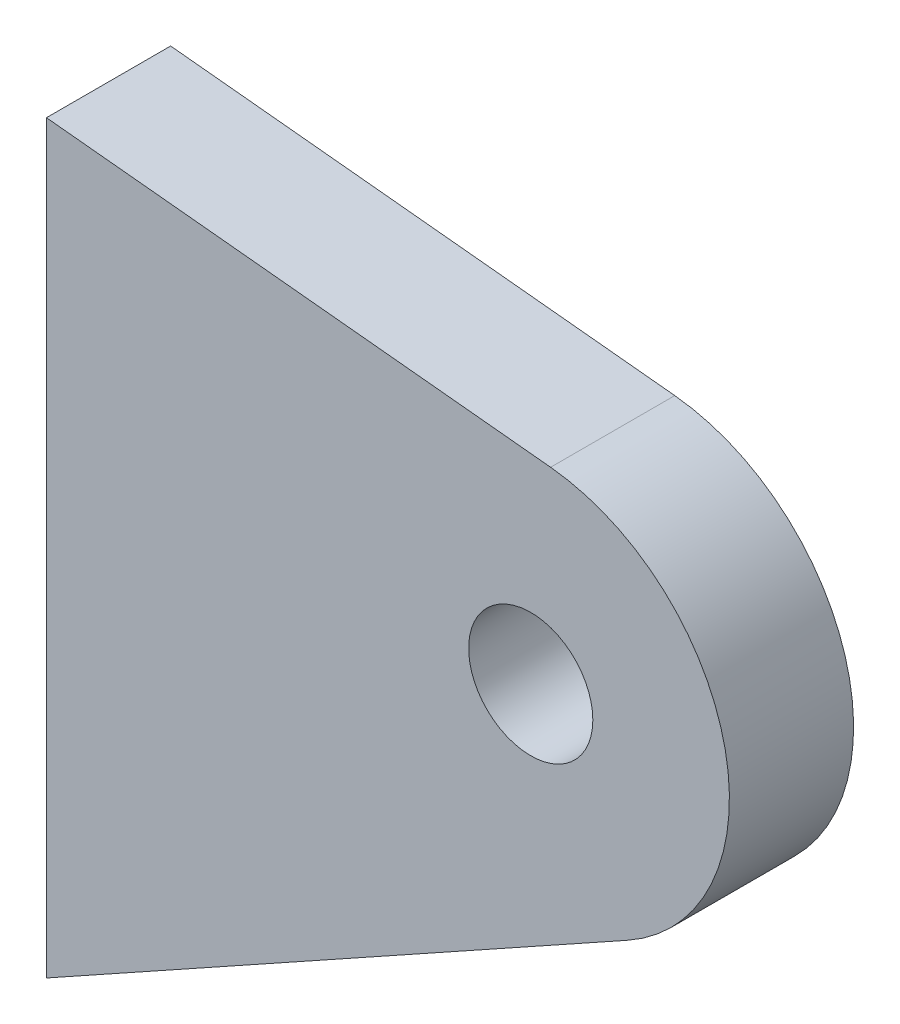
from build123d import *

# Parameters (mm, degrees)
ESQUISSE1_R               = 2.5
EXTRUSION1_DEPTH          = 5
TROU_TARAUD_M3X0_51_D     = 2.5
TROU_TARAUD_M3X0_51_DEPTH = 9.1
TROU_TARAUD_M3X0_51_TIP   = 0.751075774


with BuildPart() as part:
    # Esquisse1 → Extrusion1 (new body)
    with BuildSketch(Plane.XY):
        with BuildLine():
            Line((-19.5, 10), (-19.5, -20))
            Line((-19.5, -20), (3.888568512, -6.991354299))
            ThreePointArc((3.888568512, -6.991354299), (7.834576447, 1.618459728), (0.799950986, 7.959904423))
            Line((0.799950986, 7.959904423), (-19.5, 10))
        make_face()
        Circle(ESQUISSE1_R, mode=Mode.SUBTRACT)
    extrude(amount=EXTRUSION1_DEPTH)

    # Trou taraudé M3x0.51
    with Locations(Plane.ZY.offset(19.5)):
        with Locations((2.5, 6), (2.5, -16)):
            Hole(TROU_TARAUD_M3X0_51_D / 2, depth=TROU_TARAUD_M3X0_51_DEPTH)
            with Locations((0, 0, -(TROU_TARAUD_M3X0_51_DEPTH + TROU_TARAUD_M3X0_51_TIP / 2))):  # 118° drill point
                Cone(0, TROU_TARAUD_M3X0_51_D / 2, TROU_TARAUD_M3X0_51_TIP, mode=Mode.SUBTRACT)


solid = part.part
